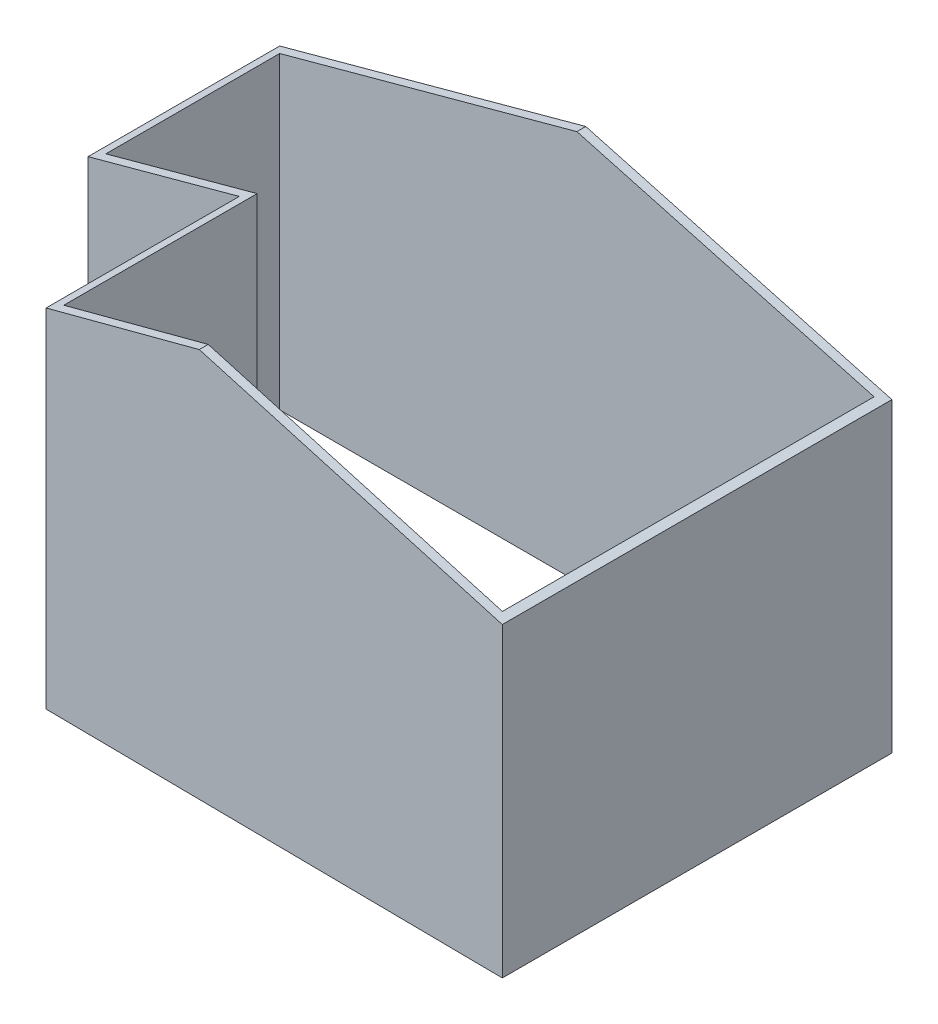
from build123d import *

# Parameters (mm, degrees)
BOSS_EXTRUDE1_DEPTH = 88.9
CUT_EXTRUDE1_DEPTH  = 102.108


with BuildPart() as part:
    # Sketch2 → Boss-Extrude1 (new body)
    with BuildSketch(Plane(origin=(0, 0, 0), x_dir=(1, 0, 0), z_dir=(0, 1, 0))):
        Polygon((-63.761896162, 30.891565806), (75.945697976, 30.891565806), (75.945697976, -58.008434194), (-29.241124355, -56.925429588), (-29.241124355, -12.83474515), (-63.761896162, -12.83474515), align=None)
        Polygon((-61.729896162, -10.80274515), (-61.729896162, 28.859565806), (73.913697976, 28.859565806), (73.913697976, -55.955405), (-27.209124355, -54.91424338), (-27.209124355, -10.80274515), align=None, mode=Mode.SUBTRACT)
    extrude(amount=BOSS_EXTRUDE1_DEPTH)

    # Sketch3 → Cut-Extrude1 (cut)
    with BuildSketch(Plane(origin=(0, 0, -30.891565806), x_dir=(-1, 0, 0), z_dir=(0, 0, -1))):
        Polygon((-75.945697976, 69.85), (-6.088103838, 88.9), (63.761896162, 69.874738021), (86.047504552, 68.33004544), (86.047504552, 107.907647221), (-94.439058548, 107.907647221), (-94.439058548, 69.85), align=None)
    extrude(amount=-CUT_EXTRUDE1_DEPTH, mode=Mode.SUBTRACT)


solid = part.part
